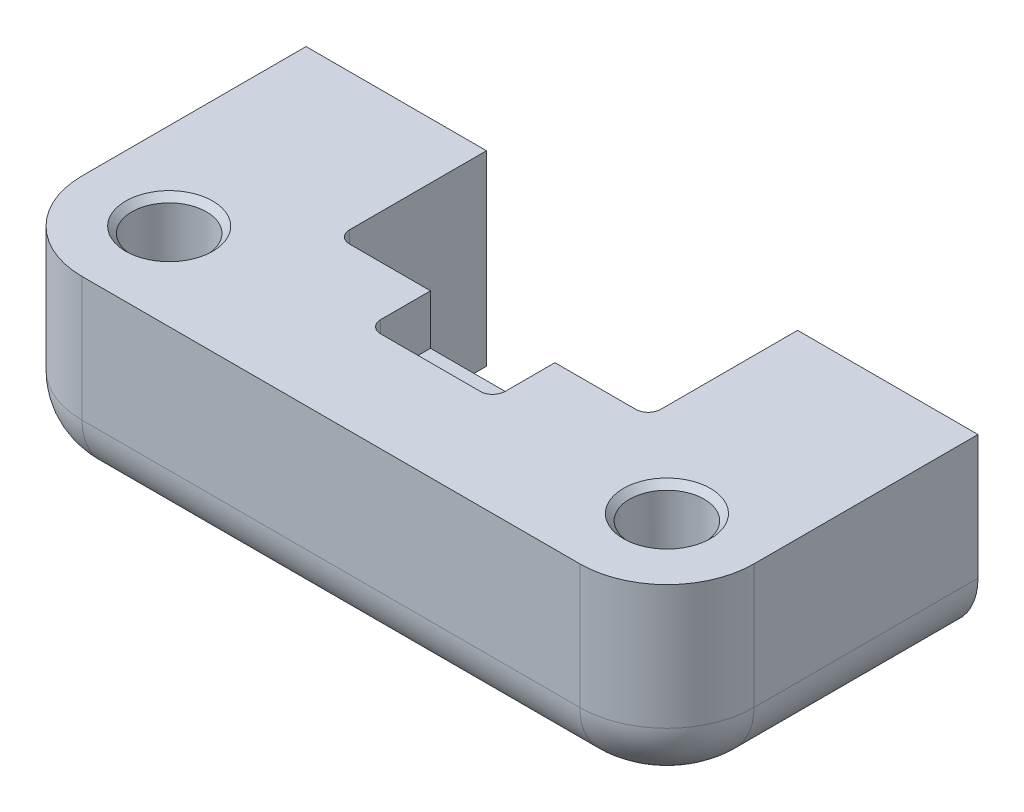
from build123d import *

# Parameters (mm, degrees)
SKETCH_1_W                = 54
SKETCH_1_H                = 15
EXTRUDE_1_DEPTH           = 25
SKETCH_2_R                = 3
CUT_EXTRUDE_4_DEPTH       = 10
SKETCH_3_R                = 2
CUT_EXTRUDE_5_DEPTH       = 9
FILLET_1_R                = 7
FILLET_2_R                = 5
CHAMFER_1_SIZE            = 0.5
CUT_EXTRUDE_11_DEPTH      = 40.736632973
CUT_EXTRUDE_11_DEPTH_BACK = 40.736632973
CUT_EXTRUDE_12_DEPTH      = 4


with BuildPart() as part:
    # 草图1 → 凸台-拉伸1 (new body)
    with BuildSketch(Plane.XY):
        Rectangle(SKETCH_1_W, SKETCH_1_H)
    extrude(amount=EXTRUDE_1_DEPTH)

    # 草图2 → 切除-拉伸4 (cut)
    with BuildSketch(Plane.XZ.offset(-7.5)):
        with Locations(Location((-20, 18, 0), (0, 0, 270))):
            Circle(SKETCH_2_R)
        with Locations(Location((20, 18, 0), (0, 0, 90))):
            Circle(SKETCH_2_R)
    extrude(amount=CUT_EXTRUDE_4_DEPTH, mode=Mode.SUBTRACT)

    # 草图3 → 切除-拉伸5 (cut)
    with BuildSketch(Plane(origin=(0, 0, 0), x_dir=(-1, 0, 0), z_dir=(0, 0, -1))):
        with Locations((-20, -2.5)):
            Circle(SKETCH_3_R)
        with Locations(Location((20, -2.5, 0), (0, 0, 180))):
            Circle(SKETCH_3_R)
    extrude(amount=-CUT_EXTRUDE_5_DEPTH, mode=Mode.SUBTRACT)

    # 圆角1
    fillet_1_edges = [part.edges().sort_by_distance(p)[0] for p in [
        (-27, 0, 25),
        (27, 0, 25),
    ]]
    fillet(fillet_1_edges, radius=FILLET_1_R)

    # 圆角2
    fillet_2_edges = [part.edges().sort_by_distance(p)[0] for p in [
        (0, -7.5, 25),
        (27, -7.5, 9),
        (-27, -7.5, 9),
        (-24.949747468, -7.5, 22.949747468),
        (24.949747468, -7.5, 22.949747468),
    ]]
    fillet(fillet_2_edges, radius=FILLET_2_R)

    # 倒角1
    chamfer_1_edges = [part.edges().sort_by_distance(p)[0] for p in [
        (-20, 7.5, 21),
        (20, 7.5, 15),
    ]]
    chamfer(chamfer_1_edges, length=CHAMFER_1_SIZE)

    # 草图4 → 切除-拉伸11 (cut, two sides: drawn at the far end of the back side and taken through both)
    with BuildSketch(Plane(origin=(0, 7.5, 0), x_dir=(1, 0, 0), z_dir=(0, 1, 0)).offset(-CUT_EXTRUDE_11_DEPTH_BACK)):
        with BuildLine():
            Line((-11.5, -12), (11.5, -12))
            ThreePointArc((11.5, -12), (12.207106781, -11.707106781), (12.5, -11))
            Line((12.5, -11), (12.5, 3))
            ThreePointArc((12.5, 3), (12.207106781, 3.707106781), (11.5, 4))
            Line((11.5, 4), (-11.5, 4))
            ThreePointArc((-11.5, 4), (-12.207106781, 3.707106781), (-12.5, 3))
            Line((-12.5, 3), (-12.5, -11))
            ThreePointArc((-12.5, -11), (-12.207106781, -11.707106781), (-11.5, -12))
        make_face()
    extrude(amount=CUT_EXTRUDE_11_DEPTH + CUT_EXTRUDE_11_DEPTH_BACK, mode=Mode.SUBTRACT)

    # 草图5 → 切除-拉伸12 (cut)
    with BuildSketch(Plane(origin=(0, 7.5, 0), x_dir=(1, 0, 0), z_dir=(0, 1, 0))):
        with BuildLine():
            Line((-4, -17), (4, -17))
            ThreePointArc((4, -17), (4.707106781, -16.707106781), (5, -16))
            Line((5, -16), (5, -12))
            Line((5, -12), (-5, -12))
            Line((-5, -12), (-5, -16))
            ThreePointArc((-5, -16), (-4.707106781, -16.707106781), (-4, -17))
        make_face()
    extrude(amount=-CUT_EXTRUDE_12_DEPTH, mode=Mode.SUBTRACT)


solid = part.part
